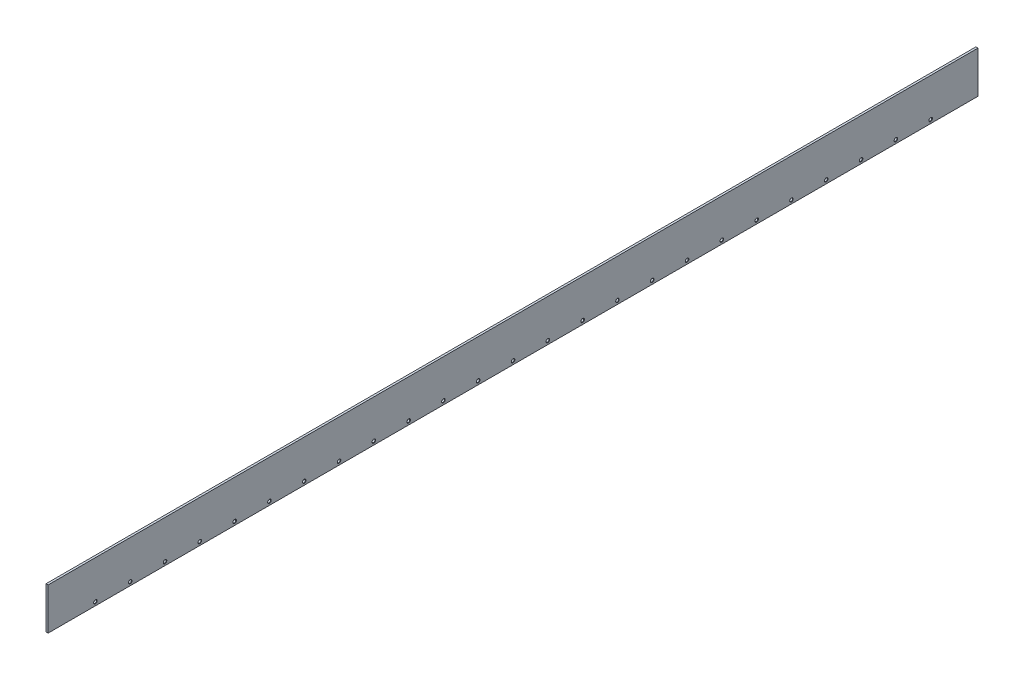
from build123d import *

# Parameters (mm, degrees)
SKETCH1_W                      = 3
SKETCH1_H                      = 60
BOSS_EXTRUDE1_DEPTH            = 668
SKETCH2_R                      = 2.05
CUT_EXTRUDE1_DEPTH             = 10
CHAMFER1_SIZE                  = 0.5
LPATTERN1_COUNT                = 13
LPATTERN1_PITCH                = 50
CHAMFER1_OF_LPATTERN1_SIZE     = 0.5
LPATTERN1_COL_COUNT            = 13
LPATTERN1_COL_PITCH            = 50
CHAMFER1_OF_LPATTERN1_COL_SIZE = 0.5


with BuildPart() as part:
    # Sketch1 → Boss-Extrude1 (new, symmetric)
    with BuildSketch(Plane.XY):
        Rectangle(SKETCH1_W, SKETCH1_H)
    extrude(amount=BOSS_EXTRUDE1_DEPTH, both=True)

    # Sketch2 → Cut-Extrude1 (cut)
    with BuildSketch(Plane(origin=(1.5, 0, 0), x_dir=(0, 0, -1), z_dir=(1, 0, 0))):
        with Locations((0, -25)):
            Circle(SKETCH2_R)
    cut_extrude1 = extrude(amount=-CUT_EXTRUDE1_DEPTH, mode=Mode.SUBTRACT)

    # Chamfer1
    chamfer1_edges = [part.edges().sort_by_distance(p)[0] for p in [
        (1.5, -25, 2.05),
    ]]
    chamfer(chamfer1_edges, length=CHAMFER1_SIZE)

    # LPattern1: Cut-Extrude1 ×13
    with Locations(*[(0, 0, -i * LPATTERN1_PITCH) for i in range(1, LPATTERN1_COUNT)]):
        add(cut_extrude1, mode=Mode.SUBTRACT)

    # Chamfer1 of LPattern1
    chamfer1_of_lpattern1_edges = [part.edges().sort_by_distance(p)[0] for p in [
        (1.5, -25, -47.95),
        (1.5, -25, -97.95),
        (1.5, -25, -147.95),
        (1.5, -25, -197.95),
        (1.5, -25, -247.95),
        (1.5, -25, -297.95),
        (1.5, -25, -347.95),
        (1.5, -25, -397.95),
        (1.5, -25, -447.95),
        (1.5, -25, -497.95),
        (1.5, -25, -547.95),
        (1.5, -25, -597.95),
    ]]
    chamfer(chamfer1_of_lpattern1_edges, length=CHAMFER1_OF_LPATTERN1_SIZE)

    # LPattern1 col: Cut-Extrude1 ×13
    with Locations(*[(0, 0, i * LPATTERN1_COL_PITCH) for i in range(1, LPATTERN1_COL_COUNT)]):
        add(cut_extrude1, mode=Mode.SUBTRACT)

    # Chamfer1 of LPattern1 col
    chamfer1_of_lpattern1_col_edges = [part.edges().sort_by_distance(p)[0] for p in [
        (1.5, -25, 52.05),
        (1.5, -25, 102.05),
        (1.5, -25, 152.05),
        (1.5, -25, 202.05),
        (1.5, -25, 252.05),
        (1.5, -25, 302.05),
        (1.5, -25, 352.05),
        (1.5, -25, 402.05),
        (1.5, -25, 452.05),
        (1.5, -25, 502.05),
        (1.5, -25, 552.05),
        (1.5, -25, 602.05),
    ]]
    chamfer(chamfer1_of_lpattern1_col_edges, length=CHAMFER1_OF_LPATTERN1_COL_SIZE)


solid = part.part
